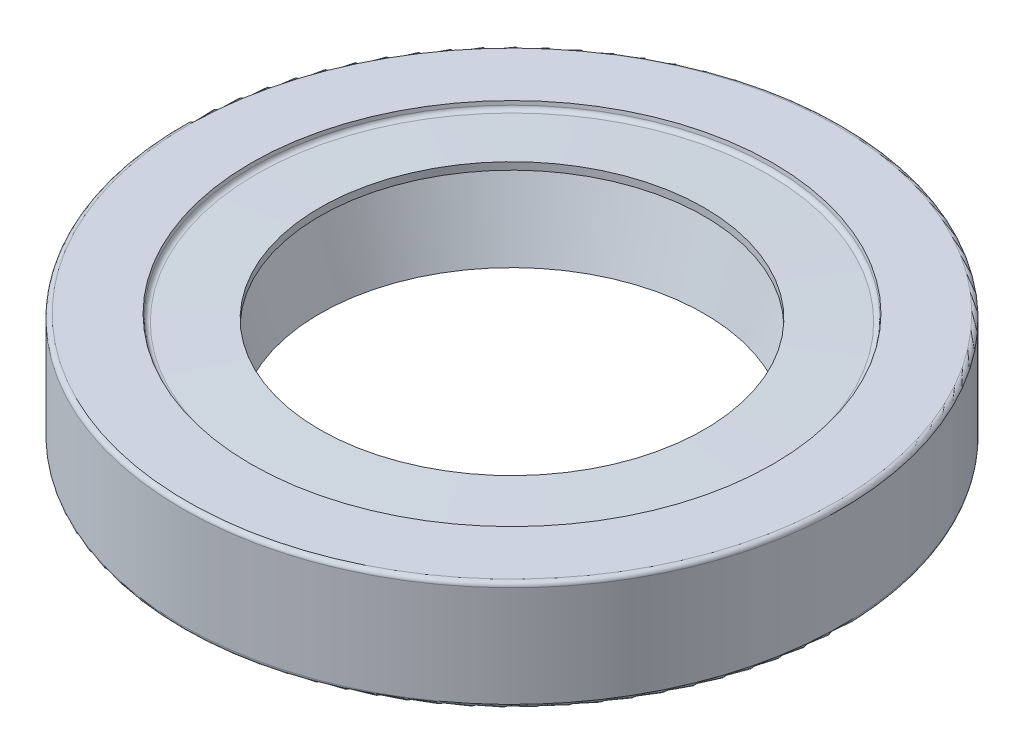
from build123d import *

# Parameters (mm, degrees)
FILLET1_R  = 0.48
FILLET2_R  = 0.48
FILLET3_R  = 0.8
SKICA1_R   = 0.6
SKICA1_R_2 = 0.59


with BuildPart() as part:
    # Sketch1 → Base-Revolve (revolve)
    with BuildSketch(Plane.XY, mode=Mode.PRIVATE) as base_revolve_sk:
        with BuildLine():
            Line((33, 0), (36, 0))
            Line((36, 0), (36, 12))
            Line((36, 12), (28.5, 12))
            Line((28.5, 12), (28.358938415, 11.2))
            Line((28.358938415, 11.2), (21, 11.52))
            Line((21, 11.52), (21, 10.72))
            Line((21, 10.72), (24.35580556, 10.72))
            Line((24.35580556, 10.72), (21, 1.5))
            Line((21, 1.5), (26.454545455, 1.5))
            Line((26.454545455, 1.5), (26.454545455, 2.166666667))
            ThreePointArc((26.454545455, 2.166666667), (25.854545455, 2.766666667), (26.454545455, 3.366666667))
            Line((26.454545455, 3.366666667), (26.454545455, 3.766666667))
            Line((26.454545455, 3.766666667), (29.489465532, 8.566666667))
            Line((29.489465532, 8.566666667), (31.489465532, 8.566666667))
            Line((31.489465532, 8.566666667), (33, 0))
        make_face()
    revolve(base_revolve_sk.sketch.rotate(Axis((0, 20.432176656, 0), (0, -1, 0)), 90), axis=Axis((0, 20.432176656, 0), (0, -1, 0)))

    # Fillet1
    fillet1_edges = [part.edges().sort_by_distance(p)[0] for p in [
        (0, 12, -36),
        (0, 0, -36),
        (0, 1.5, -26.454545455),
    ]]
    fillet(fillet1_edges, radius=FILLET1_R)

    # Fillet2
    fillet2_edges = [part.edges().sort_by_distance(p)[0] for p in [
        (0, 11.2, -28.358938415),
    ]]
    fillet(fillet2_edges, radius=FILLET2_R)

    # Fillet3
    fillet3_edges = [part.edges().sort_by_distance(p)[0] for p in [
        (0, 10.72, -24.35580556),
    ]]
    fillet(fillet3_edges, radius=FILLET3_R)


with BuildPart() as body_2:
    # Skica1 → Otočit kolem osy1 (revolve)
    with BuildSketch(Plane.XY, mode=Mode.PRIVATE) as oto_it_kolem_osy1_sk:
        with Locations((26.454545455, 2.766666667)):
            Circle(SKICA1_R)
        with Locations((26.454545455, 2.766666667)):
            Circle(SKICA1_R_2, mode=Mode.SUBTRACT)
    revolve(oto_it_kolem_osy1_sk.sketch.rotate(Axis((0, 0, 0), (0, 1, 0)), 90), axis=Axis((0, 0, 0), (0, 1, 0)))


solid = Compound([part.part, body_2.part])
